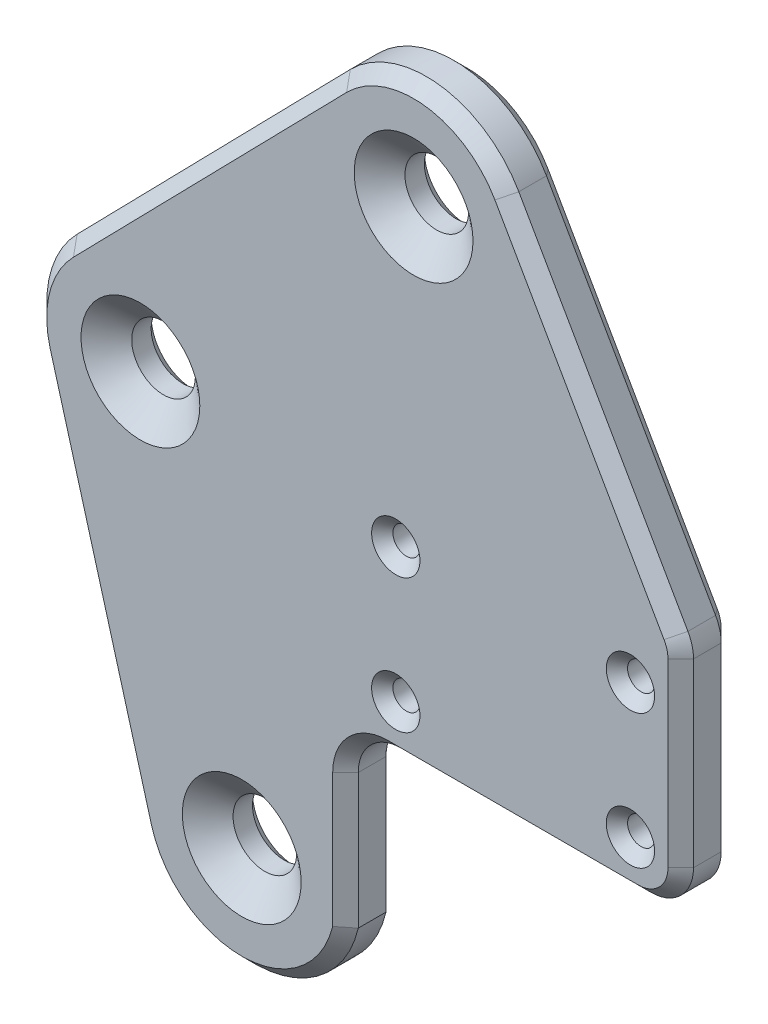
from build123d import *

# Parameters (mm, degrees)
BOSS_EXTRUDE1_DEPTH                       = 3.175
CSK_FOR_6_FLAT_HEAD_MACHINE_SCREW_2_COUNT = 2
CSK_FOR_6_FLAT_HEAD_MACHINE_SCREW_2_PITCH = 39.612434438
CSK_FOR_6_FLAT_HEAD_MACHINE_SCREW_3_COUNT = 2
CSK_FOR_6_FLAT_HEAD_MACHINE_SCREW_3_PITCH = 22.428811893
FILLET1_R                                 = 2.54
F_52_0_0635_DIAMETER_HOLE1_AT_2_COUNT     = 2
F_52_0_0635_DIAMETER_HOLE1_AT_2_PITCH     = 14
F_52_0_0635_DIAMETER_HOLE1_AT_3_COUNT     = 2
F_52_0_0635_DIAMETER_HOLE1_AT_3_PITCH     = 16.124515497
F_52_0_0635_DIAMETER_HOLE1_AT_4_COUNT     = 2
F_52_0_0635_DIAMETER_HOLE1_AT_4_PITCH     = 8
CHAMFER4_SIZE                             = 0.762


with BuildPart() as part:
    # Sketch2 → Boss-Extrude1 (new body)
    with BuildSketch(Plane.XY.offset(49.981386822)):
        with BuildLine():
            Line((-91.534347313, -223.683915635), (-71.534347313, -223.683915635))
            Line((-71.534347313, -223.683915635), (-71.534347313, -209.683915635))
            Line((-71.534347313, -209.683915635), (-81.955963126, -191.43064496))
            ThreePointArc((-81.955963126, -191.43064496), (-86.661422004, -188.280866285), (-92.010183842, -190.139143919))
            Line((-92.010183842, -190.139143919), (-108.307938293, -206.803069118))
            ThreePointArc((-108.307938293, -206.803069118), (-109.919716645, -209.667777106), (-109.883203649, -212.954576174))
            Line((-109.883203649, -212.954576174), (-103.837901654, -234.553324441))
            ThreePointArc((-103.837901654, -234.553324441), (-97.573904916, -239.190042315), (-91.534347313, -234.264542164))
            Line((-91.534347313, -234.264542164), (-91.534347313, -223.683915635))
        make_face()
    extrude(amount=BOSS_EXTRUDE1_DEPTH)

    # Sketch7 → CSK for #6 Flat Head Machine Screw (100)1 (revolve, cut)
    with BuildSketch(Plane(origin=(-97.722907594, -232.841790729, 53.156386822), x_dir=(0, -1, 0), z_dir=(1, 0, 0))):
        Polygon((0, 0), (0, 3.175), (2.53365, 3.175), (1.89865, 2.54), (1.89865, 1.380025208), (3.5433, 0), align=None)
    csk_for_6_flat_head_machine_screw_100 = revolve(axis=Axis((-97.722907594, -232.841790729, 59.506386822), (0, 0, -1)), mode=Mode.SUBTRACT)

    # CSK for _6 Flat Head Machine Screw _ 2: CSK for #6 Flat Head Machine Screw (100)1 ×2
    with Locations(*[Vector(0.25881904510252135, 0.9659258262890682, 0) * (i * CSK_FOR_6_FLAT_HEAD_MACHINE_SCREW_2_PITCH) for i in range(1, CSK_FOR_6_FLAT_HEAD_MACHINE_SCREW_2_COUNT)]):
        add(csk_for_6_flat_head_machine_screw_100, mode=Mode.SUBTRACT)

    # CSK for _6 Flat Head Machine Screw _ 3: CSK for #6 Flat Head Machine Screw (100)1 ×2
    with Locations(*[Vector(-0.2695328680059712, 0.9629911905435459, 0) * (i * CSK_FOR_6_FLAT_HEAD_MACHINE_SCREW_3_PITCH) for i in range(1, CSK_FOR_6_FLAT_HEAD_MACHINE_SCREW_3_COUNT)]):
        add(csk_for_6_flat_head_machine_screw_100, mode=Mode.SUBTRACT)

    # Fillet1
    fillet1_edges = [part.edges().sort_by_distance(p)[0] for p in [
        (-71.534347313, -209.683915635, 51.568886822),
        (-71.534347313, -223.683915635, 51.568886822),
        (-91.534347313, -223.683915635, 51.568886822),
    ]]
    fillet(fillet1_edges, radius=FILLET1_R)

    # Sketch9 → #52 (0.0635) Diameter Hole1 (revolve, cut)
    with BuildSketch(Plane(origin=(-88.534347313, -212.683915635, 53.156386822), x_dir=(0, -1, 0), z_dir=(1, 0, 0))):
        Polygon((0, 0), (0, 3.175), (1.44145, 3.175), (0.80645, 2.54), (0.80645, 0.635), (1.44145, 0), align=None)
    f_52_0_0635_diameter_hole1 = revolve(axis=Axis((-88.534347313, -212.683915635, 59.506386822), (0, 0, -1)), mode=Mode.SUBTRACT)

    # #52 (0.0635) Diameter Hole1 at 2: #52 (0.0635) Diameter Hole1 ×2
    with Locations(*[(i * F_52_0_0635_DIAMETER_HOLE1_AT_2_PITCH, 0, 0) for i in range(1, F_52_0_0635_DIAMETER_HOLE1_AT_2_COUNT)]):
        add(f_52_0_0635_diameter_hole1, mode=Mode.SUBTRACT)

    # #52 (0.0635) Diameter Hole1 at 3: #52 (0.0635) Diameter Hole1 ×2
    with Locations(*[Vector(0.86824314212446, -0.49613893835683254, 0) * (i * F_52_0_0635_DIAMETER_HOLE1_AT_3_PITCH) for i in range(1, F_52_0_0635_DIAMETER_HOLE1_AT_3_COUNT)]):
        add(f_52_0_0635_diameter_hole1, mode=Mode.SUBTRACT)

    # #52 (0.0635) Diameter Hole1 at 4: #52 (0.0635) Diameter Hole1 ×2
    with Locations(*[(0, -i * F_52_0_0635_DIAMETER_HOLE1_AT_4_PITCH, 0) for i in range(1, F_52_0_0635_DIAMETER_HOLE1_AT_4_COUNT)]):
        add(f_52_0_0635_diameter_hole1, mode=Mode.SUBTRACT)

    # Chamfer4
    chamfer4_edges = [part.edges().sort_by_distance(p)[0] for p in [
        (-97.573904916, -239.190042315, 49.981386822),
        (-106.860552651, -223.753950307, 49.981386822),
        (-109.919716645, -209.667777106, 49.981386822),
        (-100.159061068, -198.471106519, 49.981386822),
        (-86.661422004, -188.280866285, 49.981386822),
        (-86.661422004, -188.280866285, 53.156386822),
        (-100.159061068, -198.471106519, 53.156386822),
        (-109.919716645, -209.667777106, 53.156386822),
        (-106.860552651, -223.753950307, 53.156386822),
        (-97.573904916, -239.190042315, 53.156386822),
        (-76.912256817, -200.264604887, 49.981386822),
        (-76.912256817, -200.264604887, 53.156386822),
        (-91.534347313, -230.2442289, 49.981386822),
        (-71.534347313, -215.750934685, 49.981386822),
        (-81.534347313, -223.683915635, 49.981386822),
        (-72.278296088, -222.939966859, 49.981386822),
        (-71.619319422, -209.706464627, 49.981386822),
        (-71.534347313, -215.750934685, 53.156386822),
        (-91.534347313, -230.2442289, 53.156386822),
        (-81.534347313, -223.683915635, 53.156386822),
        (-72.278296088, -222.939966859, 53.156386822),
        (-71.619319422, -209.706464627, 53.156386822),
        (-90.790398537, -224.427864411, 49.981386822),
        (-90.790398537, -224.427864411, 53.156386822),
    ]]
    chamfer(chamfer4_edges, length=CHAMFER4_SIZE)


solid = part.part
